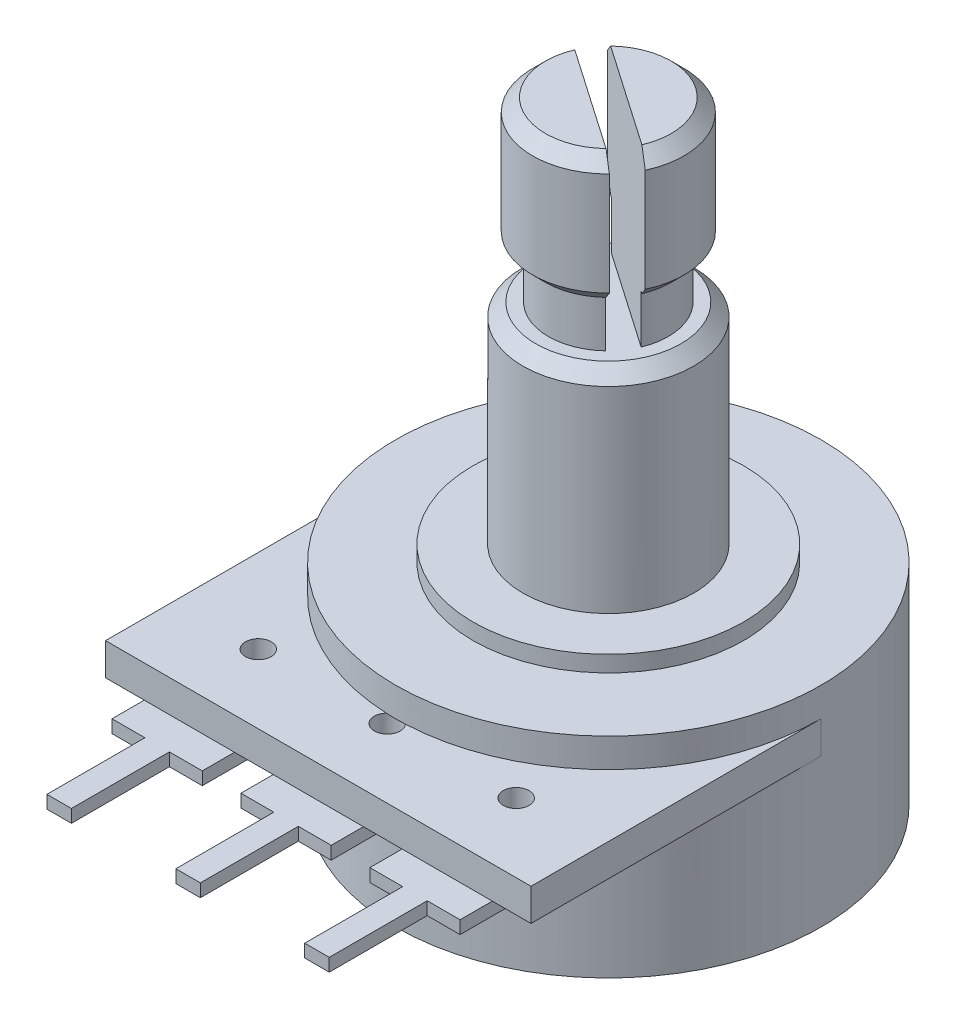
from build123d import *

# Parameters (mm, degrees)
SKETCH2_W           = 16.764
SKETCH2_H           = 1.27
BOSS_EXTRUDE1_DEPTH = 11.43
SKETCH3_R           = 0.508
BOSS_EXTRUDE2_DEPTH = 0.508
SKETCH5_R           = 8.382
SKETCH5_R_2         = 5.334
CUT_EXTRUDE2_DEPTH  = 15.875
LPATTERN1_COUNT     = 2
LPATTERN1_PITCH     = 5.08
LPATTERN2_COUNT     = 2
LPATTERN2_PITCH     = 5.08
CUT_EXTRUDE3_START  = -1.27
SKETCH7_R           = 0.508
CUT_EXTRUDE3_DEPTH  = 1.27
CUT_EXTRUDE4_DEPTH  = 6.985
CHAMFER1_SIZE       = 0.508


with BuildPart() as part:
    # Sketch1 → Base-Revolve (revolve)
    with BuildSketch(Plane.XY, mode=Mode.PRIVATE) as base_revolve_sk:
        Polygon((0, 0), (8.382, 0), (8.382, 8.89), (3.3655, 8.89), (3.3655, 17.145), (2.3622, 17.145), (2.3622, 19.05), (2.9845, 19.05), (2.9845, 24.13), (0, 24.13), align=None)
    revolve(base_revolve_sk.sketch.rotate(Axis((0, 0, 0), (0, -1, 0)), 90), axis=Axis((0, 0, 0), (0, -1, 0)))

    # Sketch2 → Boss-Extrude1 (add)
    with BuildSketch(Plane.XY):
        with Locations((0, 6.477)):
            Rectangle(SKETCH2_W, SKETCH2_H)
    extrude(amount=BOSS_EXTRUDE1_DEPTH)

    # Sketch3 → Boss-Extrude2 (add)
    with BuildSketch(Plane.XZ.offset(-5.842)):
        with BuildLine():
            Line((-1.778, 12.7), (-0.4826, 12.7))
            Line((-0.4826, 12.7), (-0.4826, 16.5608))
            Line((-0.4826, 16.5608), (0.4826, 16.5608))
            Line((0.4826, 16.5608), (0.4826, 12.7))
            Line((0.4826, 12.7), (1.778, 12.7))
            Line((1.778, 12.7), (1.778, 8.7122))
            ThreePointArc((1.778, 8.7122), (0, 6.9342), (-1.778, 8.7122))
            Line((-1.778, 8.7122), (-1.778, 12.7))
        make_face()
        with Locations((0, 8.7122)):
            Circle(SKETCH3_R, mode=Mode.SUBTRACT)
    boss_extrude2 = extrude(amount=BOSS_EXTRUDE2_DEPTH)

    # Sketch5 → Cut-Extrude2 (cut)
    with BuildSketch(Plane(origin=(0, 24.13, 0), x_dir=(-1, 0, 0), z_dir=(0, 1, 0))):
        with Locations(Location((0, 0, 0), (0, 0, 90))):
            Circle(SKETCH5_R)
        with Locations(Location((0, 0, 0), (0, 0, 90))):
            Circle(SKETCH5_R_2, mode=Mode.SUBTRACT)
    extrude(amount=-CUT_EXTRUDE2_DEPTH, mode=Mode.SUBTRACT)

    # LPattern1: Boss-Extrude2 ×2
    with Locations(*[(-i * LPATTERN1_PITCH, 0, 0) for i in range(1, LPATTERN1_COUNT)]):
        add(boss_extrude2)

    # LPattern2: Boss-Extrude2 ×2
    with Locations(*[(i * LPATTERN2_PITCH, 0, 0) for i in range(1, LPATTERN2_COUNT)]):
        add(boss_extrude2)

    # Sketch7 → Cut-Extrude3 (cut)
    with BuildSketch(Plane.XZ.offset(-5.842).offset(CUT_EXTRUDE3_START)):
        with Locations(Location((-5.08, 8.7122, 0), (0, 0, 90))):
            Circle(SKETCH7_R)
        with Locations(Location((0, 8.7122, 0), (0, 0, 221.82338942))):
            Circle(SKETCH7_R)
        with Locations(Location((5.08, 8.7122, 0), (0, 0, 90))):
            Circle(SKETCH7_R)
    extrude(amount=CUT_EXTRUDE3_DEPTH, mode=Mode.SUBTRACT)

    # Sketch8 → Cut-Extrude4 (cut)
    with BuildSketch(Plane(origin=(0, 24.13, 0), x_dir=(-1, 0, 0), z_dir=(0, 1, 0))):
        with BuildLine():
            Line((-2.708292046, 1.253951532), (2.13071284, -2.089809331))
            ThreePointArc((2.13071284, -2.089809331), (2.455332287, -1.696638916), (2.708292046, -1.253951532))
            Line((2.708292046, -1.253951532), (-2.13071284, 2.089809331))
            ThreePointArc((-2.13071284, 2.089809331), (-2.455332287, 1.696638916), (-2.708292046, 1.253951532))
        make_face()
    extrude(amount=-CUT_EXTRUDE4_DEPTH, mode=Mode.SUBTRACT)

    # Chamfer1
    chamfer1_edges = [part.edges().sort_by_distance(p)[0] for p in [
        (1.696638916, 24.13, -2.455332287),
        (-2.51492133, 24.13, 1.606988162),
        (1.696638916, 19.05, -2.455332287),
        (-2.51492133, 19.05, 1.606988162),
        (0, 17.145, -3.3655),
    ]]
    chamfer(chamfer1_edges, length=CHAMFER1_SIZE)


solid = part.part
